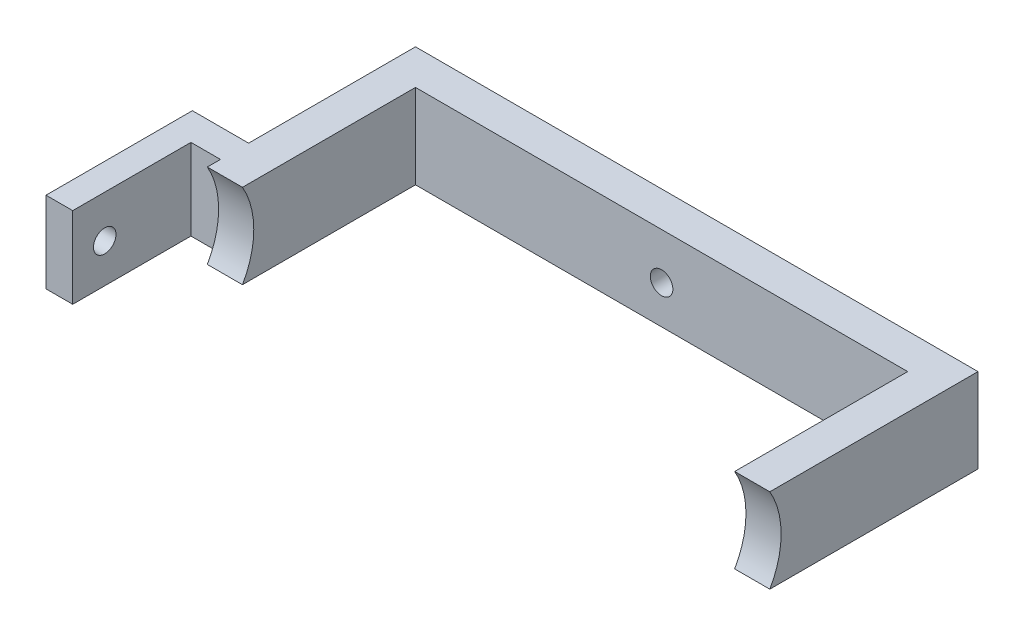
from build123d import *

# Parameters (mm, degrees)
SKETCH1_W                = 200
SKETCH1_H                = 200
BOSS_EXTRUDE1_DEPTH      = 30
SKETCH4_W                = 175
SKETCH4_H                = 175
CUT_EXTRUDE1_DEPTH       = 30
SKETCH7_R                = 4
CUT_EXTRUDE2_DEPTH       = 210
SKETCH10_W               = 6.040230253
SKETCH10_H               = 30
BOSS_EXTRUDE2_DEPTH      = 20
SKETCH11_W               = 10
SKETCH11_H               = 30
BOSS_EXTRUDE3_DEPTH      = 20
CUT_EXTRUDE3_START       = -231
SKETCH12_R               = 4
CUT_EXTRUDE3_DEPTH       = 231
SKETCH13_R               = 4
CUT_EXTRUDE5_DEPTH       = 231
SKETCH14_R               = 4
CUT_EXTRUDE6_DEPTH       = 250.5
SKETCH15_R               = 30
SKETCH15_R_2             = 22
BOSS_EXTRUDE5_DEPTH      = 201
SKETCH17_R               = 22
CUT_EXTRUDE7_DEPTH       = 201
SKETCH21_W               = 9.5
SKETCH21_H               = 28.855904386
BOSS_EXTRUDE6_DEPTH      = 26
SKETCH22_W               = 9.5
SKETCH22_H               = 6.040230253
CUT_EXTRUDE10_DEPTH      = 49
SKETCH23_W               = 10.008922512
SKETCH23_H               = 28.855904386
BOSS_EXTRUDE7_DEPTH      = 21
SKETCH24_W               = 9.5
SKETCH24_H               = 1.144095614
CUT_EXTRUDE11_DEPTH      = 27
SKETCH26_W               = 0.50137975
SKETCH26_H               = 20.893624798
CUT_EXTRUDE12_DEPTH      = 35
SKETCH27_R               = 49.192783102
CUT_EXTRUDE13_DEPTH      = 175
SKETCH28_R               = 41.209023923
CUT_EXTRUDE14_DEPTH      = 175
CUT_EXTRUDE15_DEPTH      = 246.814971066
CUT_EXTRUDE15_DEPTH_BACK = 210


with BuildPart() as part:
    # Sketch1 → Boss-Extrude1 (new body)
    with BuildSketch(Plane(origin=(0, 0, 0), x_dir=(1, 0, 0), z_dir=(0, 1, 0))):
        Rectangle(SKETCH1_W, SKETCH1_H)
    extrude(amount=BOSS_EXTRUDE1_DEPTH)

    # Sketch4 → Cut-Extrude1 (cut)
    with BuildSketch(Plane(origin=(0, 30, 0), x_dir=(1, 0, 0), z_dir=(0, 1, 0))):
        Rectangle(SKETCH4_W, SKETCH4_H)
    extrude(amount=-CUT_EXTRUDE1_DEPTH, mode=Mode.SUBTRACT)

    # Sketch7 → Cut-Extrude2 (cut)
    with BuildSketch(Plane.ZY.offset(100)):
        with Locations((0, 15)):
            Circle(SKETCH7_R)
    extrude(amount=-CUT_EXTRUDE2_DEPTH, mode=Mode.SUBTRACT)

    # Sketch10 → Boss-Extrude2 (add)
    with BuildSketch(Plane.ZY.offset(100)):
        with Locations((-11.64671233, 15)):
            Rectangle(SKETCH10_W, SKETCH10_H)
    extrude(amount=BOSS_EXTRUDE2_DEPTH)

    # Sketch11 → Boss-Extrude3 (add)
    with BuildSketch(Plane.XY.offset(-8.626597203)):
        with Locations((-115, 15)):
            Rectangle(SKETCH11_W, SKETCH11_H)
    extrude(amount=BOSS_EXTRUDE3_DEPTH)

    # Sketch12 → Cut-Extrude3 (cut)
    with BuildSketch(Plane(origin=(100, 0, 0), x_dir=(0, 0, -1), z_dir=(1, 0, 0)).offset(CUT_EXTRUDE3_START)):
        with Locations(Location((0, 15, 0), (0, 0, 180))):
            Circle(SKETCH12_R)
    extrude(amount=CUT_EXTRUDE3_DEPTH, mode=Mode.SUBTRACT)

    # Sketch13 → Cut-Extrude5 (cut)
    with BuildSketch(Plane(origin=(0, 30, 0), x_dir=(1, 0, 0), z_dir=(0, 1, 0))):
        with Locations(Location((-93.69452155, -93.045501349, 0), (0, 0, 270))):
            Circle(SKETCH13_R)
    extrude(amount=-CUT_EXTRUDE5_DEPTH, mode=Mode.SUBTRACT)

    # Sketch14 → Cut-Extrude6 (cut)
    with BuildSketch(Plane.XY.offset(100)):
        with Locations((0, 13.614739596)):
            Circle(SKETCH14_R)
    extrude(amount=-CUT_EXTRUDE6_DEPTH, mode=Mode.SUBTRACT)

    # Sketch15 → Boss-Extrude5 (add)
    with BuildSketch(Plane(origin=(100, 0, 0), x_dir=(0, 0, -1), z_dir=(1, 0, 0))):
        with Locations((0, 15)):
            Circle(SKETCH15_R)
        with Locations((0, 15)):
            Circle(SKETCH15_R_2, mode=Mode.SUBTRACT)
    extrude(amount=-BOSS_EXTRUDE5_DEPTH)

    # Sketch17 → Cut-Extrude7 (cut)
    with BuildSketch(Plane(origin=(100, 0, 0), x_dir=(0, 0, -1), z_dir=(1, 0, 0))):
        with Locations((0.074377339, 15.100772812)):
            Circle(SKETCH17_R)
    extrude(amount=-CUT_EXTRUDE7_DEPTH, mode=Mode.SUBTRACT)


with BuildPart() as cut_extrude7_piece_1:
    # of the separate pieces the step leaves, piece 1, a body of its own (cut_extrude7_pieces)
    add(part.part.solids().sort_by_distance((-100, 0, -100))[0])



with BuildPart() as cut_extrude7_piece_2:
    # of the separate pieces the step leaves, piece 2, a body of its own (cut_extrude7_pieces)
    add(part.part.solids().sort_by_distance((-101, 0, -14.666827456))[0])

    # Sketch21 → Boss-Extrude6 (add)
    with BuildSketch(Plane(origin=(0, 0, -14.666827456), x_dir=(-1, 0, 0), z_dir=(0, 0, -1))):
        with Locations((115.25, 15.572047807)):
            Rectangle(SKETCH21_W, SKETCH21_H)
    extrude(amount=BOSS_EXTRUDE6_DEPTH)

    # Sketch22 → Cut-Extrude10 (cut)
    with BuildSketch(Plane(origin=(0, 30, 0), x_dir=(1, 0, 0), z_dir=(0, 1, 0))):
        with Locations((-105.75, 11.64671233)):
            Rectangle(SKETCH22_W, SKETCH22_H)
    extrude(amount=-CUT_EXTRUDE10_DEPTH, mode=Mode.SUBTRACT)


with BuildPart() as cut_extrude7_piece_1_1:
    add(cut_extrude7_piece_1.part)

    add(cut_extrude7_piece_2.part)  # Boss-Extrude7 merges Cut-Extrude7 piece 2
    # Sketch23 → Boss-Extrude7 (add)
    with BuildSketch(Plane(origin=(-110.5, 0, 0), x_dir=(0, 0, -1), z_dir=(1, 0, 0))):
        with Locations((35.6623662, 15.572047807)):
            Rectangle(SKETCH23_W, SKETCH23_H)
    extrude(amount=BOSS_EXTRUDE7_DEPTH)

    # Sketch24 → Cut-Extrude11 (cut)
    with BuildSketch(Plane(origin=(0, 0, -14.666827456), x_dir=(-1, 0, 0), z_dir=(0, 0, -1))):
        with Locations((115.25, 0.572047807)):
            Rectangle(SKETCH24_W, SKETCH24_H)
    extrude(amount=-CUT_EXTRUDE11_DEPTH, mode=Mode.SUBTRACT)

    # Sketch26 → Cut-Extrude12 (cut)
    with BuildSketch(Plane.XZ):
        with Locations((-110.249310125, 1.820215196)):
            Rectangle(SKETCH26_W, SKETCH26_H)
    extrude(amount=-CUT_EXTRUDE12_DEPTH, mode=Mode.SUBTRACT)

    # Sketch27 → Cut-Extrude13 (cut)
    with BuildSketch(Plane(origin=(-87.5, 0, 0), x_dir=(0, 0, -1), z_dir=(1, 0, 0))):
        with Locations((-31.916352411, 15.376133278)):
            Circle(SKETCH27_R)
    extrude(amount=CUT_EXTRUDE13_DEPTH, mode=Mode.SUBTRACT)

    # Sketch28 → Cut-Extrude14 (cut)
    with BuildSketch(Plane(origin=(-87.5, 0, 0), x_dir=(0, 0, -1), z_dir=(1, 0, 0))):
        with Locations((37.762434774, 15.494435184)):
            Circle(SKETCH28_R)
    extrude(amount=CUT_EXTRUDE14_DEPTH, mode=Mode.SUBTRACT)

    # Sketch30 → Cut-Extrude15 (cut, two sides: drawn at the far end of the back side and taken through both)
    with BuildSketch(Plane(origin=(100, 0, 0), x_dir=(0, 0, -1), z_dir=(1, 0, 0)).offset(-CUT_EXTRUDE15_DEPTH_BACK)):
        with BuildLine():
            Line((-112.795739645, -240.367951942), (25.980762114, 0))
            ThreePointArc((25.980762114, 0), (30, 15), (25.980762114, 30))
            Line((25.980762114, 30), (-112.795739645, 270.367951942))
            Line((-112.795739645, 270.367951942), (-667.901746678, 270.367951942))
            Line((-667.901746678, 270.367951942), (-667.901746678, -240.367951942))
            Line((-667.901746678, -240.367951942), (-112.795739645, -240.367951942))
        make_face()
    extrude(amount=CUT_EXTRUDE15_DEPTH + CUT_EXTRUDE15_DEPTH_BACK, mode=Mode.SUBTRACT)


solid = cut_extrude7_piece_1_1.part
